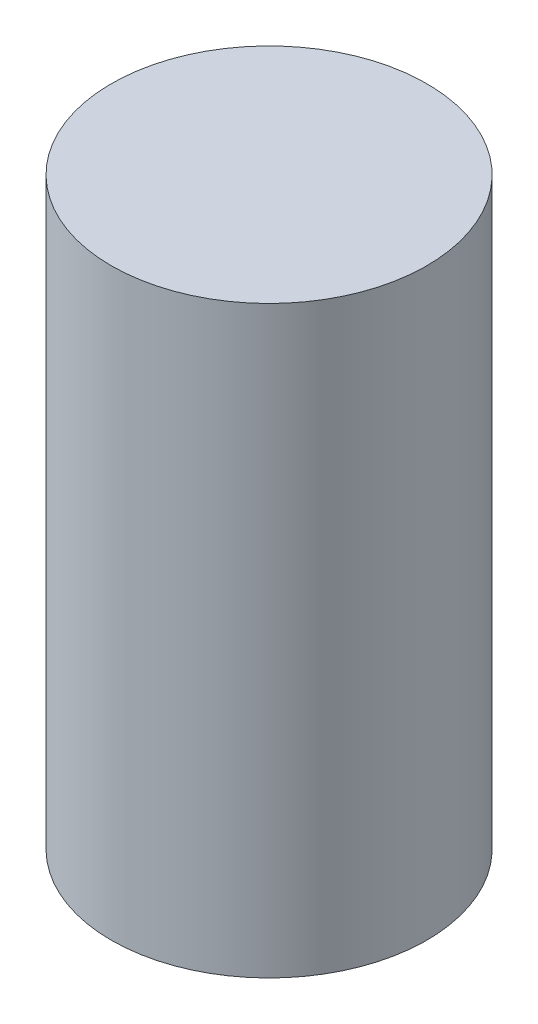
from build123d import *

# Parameters (mm, degrees)
SKETCH1_R           = 13.5
BOSS_EXTRUDE1_DEPTH = 50


with BuildPart() as part:
    # Sketch1 → Boss-Extrude1 (new body)
    with BuildSketch(Plane(origin=(0, 0, 0), x_dir=(1, 0, 0), z_dir=(0, 1, 0))):
        with Locations(Location((0, 0, 0), (0, 0, 270))):
            Circle(SKETCH1_R)
    extrude(amount=BOSS_EXTRUDE1_DEPTH)


solid = part.part
